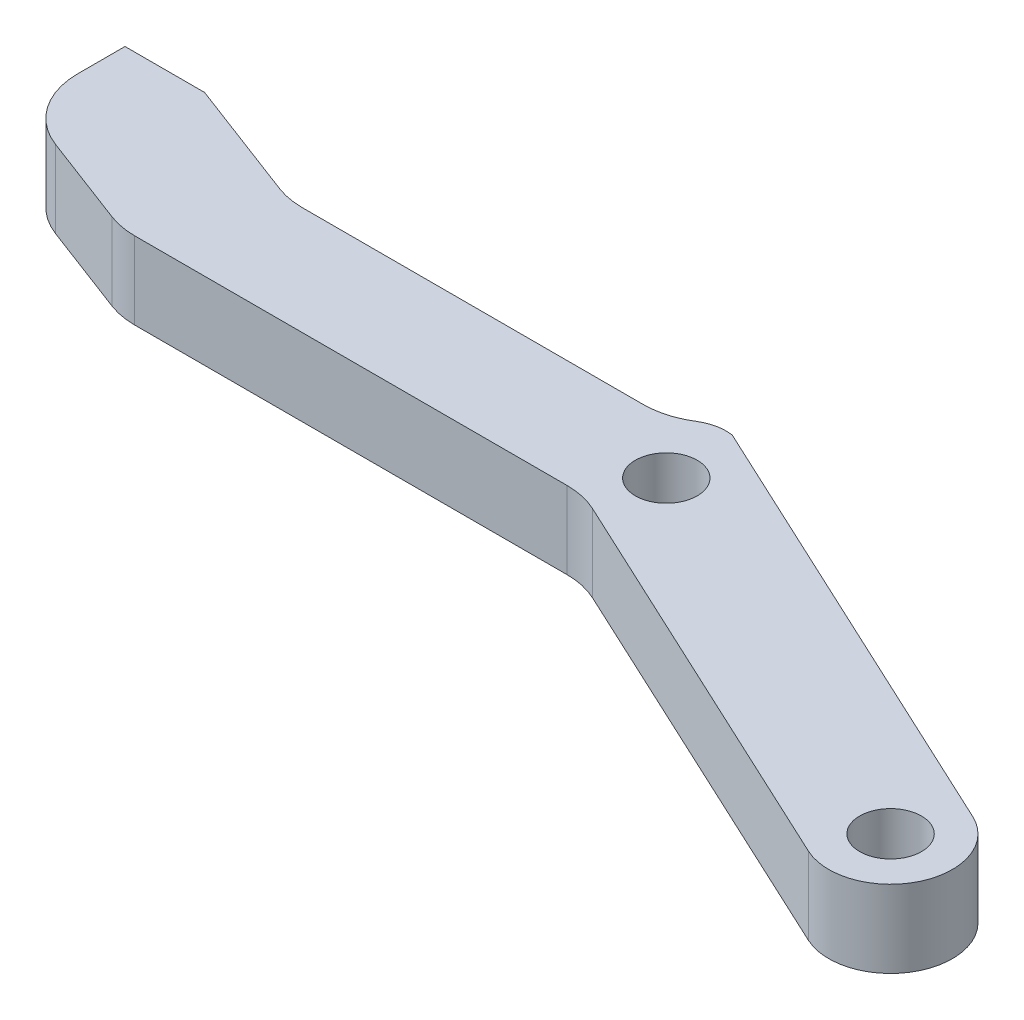
from build123d import *

# Parameters (mm, degrees)
ESQUISSE1_R        = 2
BOSS_EXTRU_1_DEPTH = 5
CONG_1_R           = 5


with BuildPart() as part:
    # Esquisse1 → Boss.-Extru.1 (new body)
    with BuildSketch(Plane(origin=(0, 0, 0), x_dir=(1, 0, 0), z_dir=(0, 1, 0))):
        with BuildLine():
            Line((0, 10.29493472), (0, 3.789721085))
            Line((0, 3.789721085), (10, 0))
            Line((10, 0), (40, 0))
            Line((40, 0), (67.189233611, -12.678547852))
            ThreePointArc((67.189233611, -12.678547852), (72.504937806, -10.743789751), (70.570179705, -5.428085556))
            Line((70.570179705, -5.428085556), (41.421148718, 8.164330821))
            ThreePointArc((41.421148718, 8.164330821), (39.877944642, 7.977690672), (38.669460337, 7))
            Line((38.669460337, 7), (13.843067102, 7))
            Line((13.843067102, 7), (5.148668105, 10.29493472))
            Line((5.148668105, 10.29493472), (0, 10.29493472))
        make_face()
        with Locations(Location((68.879706658, -9.053316704, 0), (0, 0, 270))):
            Circle(ESQUISSE1_R, mode=Mode.SUBTRACT)
        with Locations(Location((41.690473047, 3.625231148, 0), (0, 0, 270))):
            Circle(ESQUISSE1_R, mode=Mode.SUBTRACT)
    extrude(amount=BOSS_EXTRU_1_DEPTH)

    # Congé1
    cong_1_edges = [part.edges().sort_by_distance(p)[0] for p in [
        (13.843067102, 2.5, -7),
        (38.669460337, 2.5, -7),
        (40, 2.5, 0),
        (10, 2.5, 0),
        (0, 2.5, -3.789721085),
    ]]
    fillet(cong_1_edges, radius=CONG_1_R)


solid = part.part
